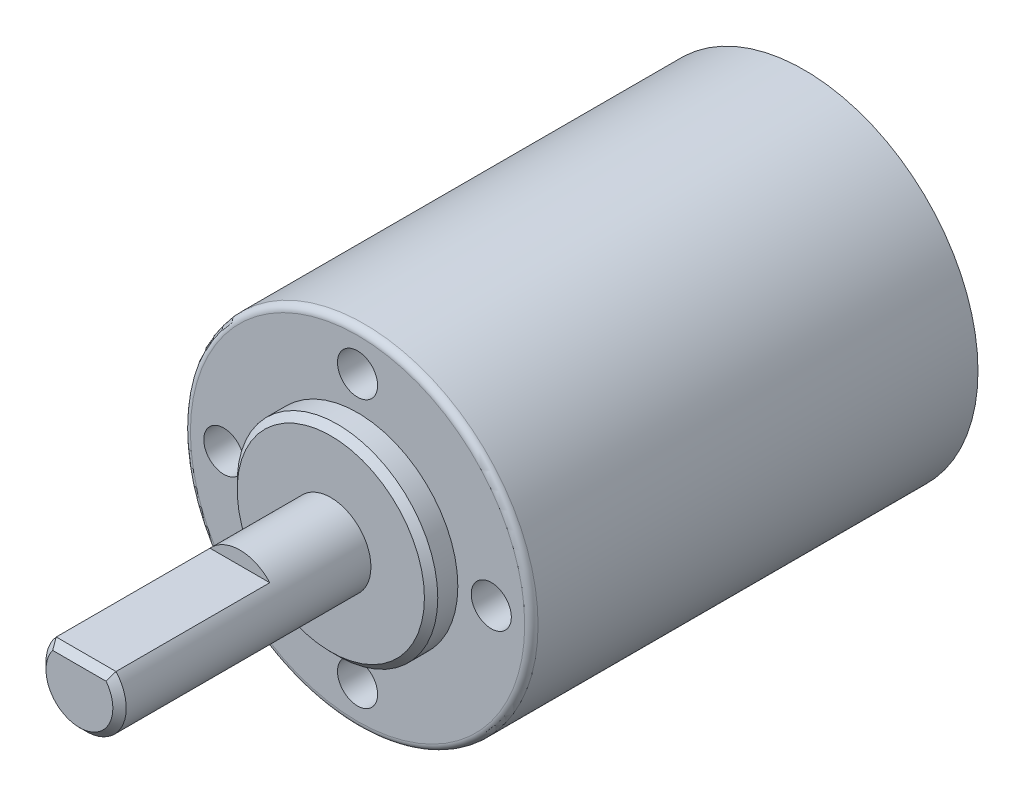
from build123d import *

# Parameters (mm, degrees)
ESQUISSE1_R             = 13
BOSS_EXTRU_1_DEPTH      = 33.4
ESQUISSE2_R             = 7.5
BOSS_EXTRU_2_DEPTH      = 2
ESQUISSE3_R             = 3
BOSS_EXTRU_3_DEPTH      = 18.8
ENL_V_START             = -12
ENL_V_MAT_EXTRU_1_DEPTH = 12
CHANFREIN1_SIZE         = 0.5
ESQUISSE5_R             = 1.5
ENL_V_MAT_EXTRU_2_DEPTH = 5
CONG_1_R                = 0.5


with BuildPart() as part:
    # Esquisse1 → Boss.-Extru.1 (new body)
    with BuildSketch(Plane.XY):
        Circle(ESQUISSE1_R)
    extrude(amount=BOSS_EXTRU_1_DEPTH)

    # Esquisse2 → Boss.-Extru.2 (add)
    with BuildSketch(Plane.XY.offset(33.4)):
        Circle(ESQUISSE2_R)
    extrude(amount=BOSS_EXTRU_2_DEPTH)

    # Esquisse3 → Boss.-Extru.3 (add)
    with BuildSketch(Plane.XY.offset(35.4)):
        Circle(ESQUISSE3_R)
    extrude(amount=BOSS_EXTRU_3_DEPTH)

    # Esquisse4 → Enlèv. mat.-Extru.1 (cut)
    with BuildSketch(Plane.XY.offset(54.2).offset(ENL_V_START)):
        with BuildLine():
            Line((-2.236067977, 2), (2.236067977, 2))
            ThreePointArc((2.236067977, 2), (0, 3), (-2.236067977, 2))
        make_face()
    extrude(amount=ENL_V_MAT_EXTRU_1_DEPTH, mode=Mode.SUBTRACT)

    # Chanfrein1
    chanfrein1_edges = [part.edges().sort_by_distance(p)[0] for p in [
        (-1.070466269, -2.802517077, 54.2),
        (0, 2, 54.2),
        (-7.5, 0, 35.4),
    ]]
    chamfer(chanfrein1_edges, length=CHANFREIN1_SIZE)

    # Esquisse5 → Enlèv. mat.-Extru.2 (cut)
    with BuildSketch(Plane.XY.offset(33.4)):
        with Locations((0, 10)):
            Circle(ESQUISSE5_R)
        with Locations((10, 0)):
            Circle(ESQUISSE5_R)
        with Locations((0, -10)):
            Circle(ESQUISSE5_R)
        with Locations((-10, 0)):
            Circle(ESQUISSE5_R)
    extrude(amount=-ENL_V_MAT_EXTRU_2_DEPTH, mode=Mode.SUBTRACT)

    # Congé1
    cong_1_edges = [part.edges().sort_by_distance(p)[0] for p in [
        (-13, 0, 33.4),
    ]]
    fillet(cong_1_edges, radius=CONG_1_R)


solid = part.part
